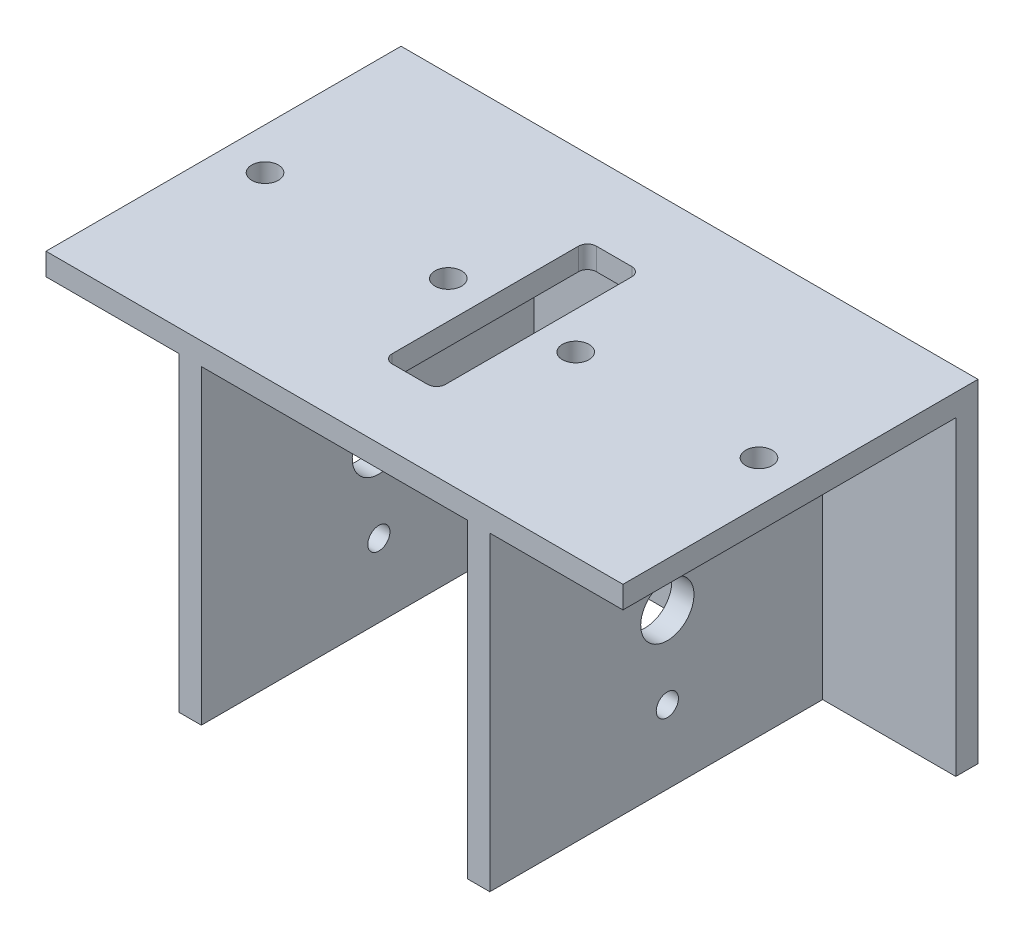
from build123d import *

# Parameters (mm, degrees)
SKETCH1_W               = 130
SKETCH1_H               = 80
SKETCH1_R               = 3
SKETCH1_W_2             = 12
SKETCH1_H_2             = 46
BOSS_EXTRUDE1_DEPTH     = 5
FILLET1_R               = 2
SKETCH2_W               = 130
SKETCH2_H               = 5
BOSS_EXTRUDE2_DEPTH     = 70
SKETCH3_W               = 5
SKETCH3_H               = 70
BOSS_EXTRUDE3_DEPTH     = 75
CUT_EXTRUDE1_DEPTH      = 129.452325787
CUT_EXTRUDE1_DEPTH_BACK = 129.452325787
SKETCH4_R               = 6
SKETCH4_R_2             = 2.5


with BuildPart() as part:
    # Sketch1 → Boss-Extrude1 (new body)
    with BuildSketch(Plane(origin=(0, 0, 0), x_dir=(1, 0, 0), z_dir=(0, 1, 0))):
        Rectangle(SKETCH1_W, SKETCH1_H)
        with Locations(Location((-14.35, 0, 0), (0, 0, 270))):
            Circle(SKETCH1_R, mode=Mode.SUBTRACT)
        with Locations(Location((-55.65, 0, 0), (0, 0, 270))):
            Circle(SKETCH1_R, mode=Mode.SUBTRACT)
        with Locations(Location((55.65, 0, 0), (0, 0, 90))):
            Circle(SKETCH1_R, mode=Mode.SUBTRACT)
        with Locations(Location((14.35, 0, 0), (0, 0, 90))):
            Circle(SKETCH1_R, mode=Mode.SUBTRACT)
        Rectangle(SKETCH1_W_2, SKETCH1_H_2, mode=Mode.SUBTRACT)
    extrude(amount=BOSS_EXTRUDE1_DEPTH)

    # Fillet1
    fillet1_edges = [part.edges().sort_by_distance(p)[0] for p in [
        (-6, 2.5, -23),
        (-6, 2.5, 23),
        (6, 2.5, 23),
        (6, 2.5, -23),
    ]]
    fillet(fillet1_edges, radius=FILLET1_R)

    # Sketch2 → Boss-Extrude2 (add)
    with BuildSketch(Plane.XZ):
        with Locations((0, -37.5)):
            Rectangle(SKETCH2_W, SKETCH2_H)
    extrude(amount=BOSS_EXTRUDE2_DEPTH)

    # Sketch3 → Boss-Extrude3 (add)
    with BuildSketch(Plane.XY.offset(-35)):
        with Locations((-32.5, -35)):
            Rectangle(SKETCH3_W, SKETCH3_H)
        with Locations((32.5, -35)):
            Rectangle(SKETCH3_W, SKETCH3_H)
    extrude(amount=BOSS_EXTRUDE3_DEPTH)

    # Sketch4 → Cut-Extrude1 (cut, two sides: drawn at the far end of the back side and taken through both)
    with BuildSketch(Plane.ZY.offset(35).offset(-CUT_EXTRUDE1_DEPTH_BACK)):
        with Locations(Location((0, -35, 0), (0, 0, 270))):
            Circle(SKETCH4_R)
        with Locations(Location((0, -16.5, 0), (0, 0, 270))):
            Circle(SKETCH4_R_2)
        with Locations(Location((0, -53.5, 0), (0, 0, 270))):
            Circle(SKETCH4_R_2)
    extrude(amount=CUT_EXTRUDE1_DEPTH + CUT_EXTRUDE1_DEPTH_BACK, mode=Mode.SUBTRACT)


solid = part.part
